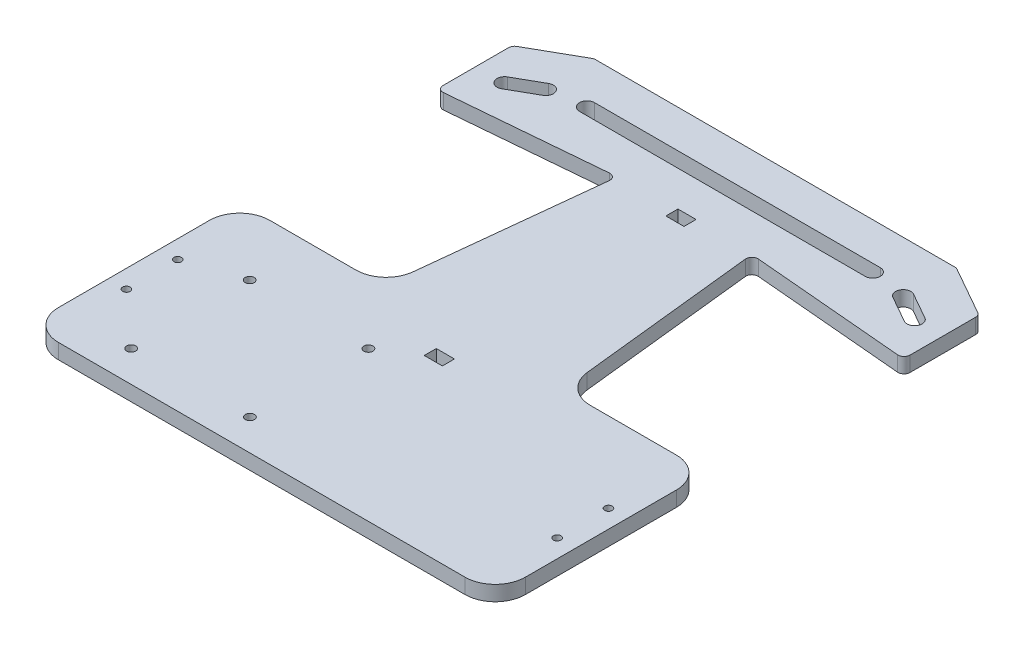
from build123d import *

# Parameters (mm, degrees)
SKETCH4_R           = 1.25
SKETCH4_R_2         = 1.5
SKETCH4_W           = 6
SKETCH4_H           = 4
BOSS_EXTRUDE1_DEPTH = 5
FILLET2_R           = 2


with BuildPart() as part:
    # Sketch4 → Boss-Extrude1 (new body)
    with BuildSketch(Plane(origin=(0, 0, 0), x_dir=(1, 0, 0), z_dir=(0, 1, 0))):
        with BuildLine():
            Line((67.306888039, -98.001348092), (-67.306888039, -98.001348092))
            ThreePointArc((-67.306888039, -98.001348092), (-74.37795585, -95.072415903), (-77.306888039, -88.001348092))
            Line((-77.306888039, -88.001348092), (-77.306888039, -38.001348092))
            ThreePointArc((-77.306888039, -38.001348092), (-74.37795585, -30.93028028), (-67.306888039, -28.001348092))
            Line((-67.306888039, -28.001348092), (-38.78630833, -28.001348092))
            ThreePointArc((-38.78630833, -28.001348092), (-32.105125256, -25.441898658), (-28.843972229, -19.073706639))
            Line((-28.843972229, -19.073706639), (-22.256841696, 41.998651908))
            Line((-22.256841696, 41.998651908), (-75.132576553, 37.372624533))
            ThreePointArc((-75.132576553, 37.372624533), (-76.658068454, 37.890459255), (-77.306888039, 39.365013929))
            Line((-77.306888039, 39.365013929), (-77.306888039, 62.182396927))
            Line((-77.306888039, 62.182396927), (-60, 71.998651908))
            Line((-60, 71.998651908), (60, 71.998651908))
            Line((60, 71.998651908), (77.306888039, 62.182396927))
            Line((77.306888039, 62.182396927), (77.306888039, 39.365013929))
            ThreePointArc((77.306888039, 39.365013929), (76.658068454, 37.890459255), (75.132576553, 37.372624533))
            Line((75.132576553, 37.372624533), (22.256841696, 41.998651908))
            Line((22.256841696, 41.998651908), (28.843972229, -19.073706639))
            ThreePointArc((28.843972229, -19.073706639), (32.105125256, -25.441898658), (38.78630833, -28.001348092))
            Line((38.78630833, -28.001348092), (67.306888039, -28.001348092))
            ThreePointArc((67.306888039, -28.001348092), (74.37795585, -30.93028028), (77.306888039, -38.001348092))
            Line((77.306888039, -38.001348092), (77.306888039, -88.001348092))
            ThreePointArc((77.306888039, -88.001348092), (74.37795585, -95.072415903), (67.306888039, -98.001348092))
        make_face()
        with Locations(Location((71.306888039, -54.501348092, 0), (0, 0, 270))):
            Circle(SKETCH4_R, mode=Mode.SUBTRACT)
        with Locations(Location((71.306888039, -71.501348092, 0), (0, 0, 270))):
            Circle(SKETCH4_R, mode=Mode.SUBTRACT)
        with Locations(Location((-71.306888039, -71.501348092, 0), (0, 0, 90))):
            Circle(SKETCH4_R, mode=Mode.SUBTRACT)
        with Locations(Location((-71.306888039, -54.501348092, 0), (0, 0, 90))):
            Circle(SKETCH4_R, mode=Mode.SUBTRACT)
        with Locations(Location((-53.526888039, -87.701348092, 0), (0, 0, 270))):
            Circle(SKETCH4_R_2, mode=Mode.SUBTRACT)
        with Locations(Location((-53.526888039, -48.461348092, 0), (0, 0, 270))):
            Circle(SKETCH4_R_2, mode=Mode.SUBTRACT)
        with Locations(Location((-14.216888039, -48.461348092, 0), (0, 0, 270))):
            Circle(SKETCH4_R_2, mode=Mode.SUBTRACT)
        with Locations(Location((-14.216888039, -87.701348092, 0), (0, 0, 270))):
            Circle(SKETCH4_R_2, mode=Mode.SUBTRACT)
        with BuildLine():
            Line((-47.306888039, 59.498651908), (47.306888039, 59.498651908))
            ThreePointArc((47.306888039, 59.498651908), (49.806888039, 56.998651908), (47.306888039, 54.498651908))
            Line((47.306888039, 54.498651908), (-47.306888039, 54.498651908))
            ThreePointArc((-47.306888039, 54.498651908), (-49.806888039, 56.998651908), (-47.306888039, 59.498651908))
        make_face(mode=Mode.SUBTRACT)
        with BuildLine():
            Line((-57.941248655, 53.047423499), (-66.639525671, 48.113867281))
            ThreePointArc((-66.639525671, 48.113867281), (-70.047483979, 49.055047481), (-69.10630378, 52.463005789))
            Line((-69.10630378, 52.463005789), (-60.408026764, 57.396562007))
            ThreePointArc((-60.408026764, 57.396562007), (-57.000068455, 56.455381807), (-57.941248655, 53.047423499))
        make_face(mode=Mode.SUBTRACT)
        with BuildLine():
            Line((57.941248655, 53.047423499), (66.639525671, 48.113867281))
            ThreePointArc((66.639525671, 48.113867281), (70.047483979, 49.055047481), (69.10630378, 52.463005789))
            Line((69.10630378, 52.463005789), (60.408026764, 57.396562007))
            ThreePointArc((60.408026764, 57.396562007), (57.000068455, 56.455381807), (57.941248655, 53.047423499))
        make_face(mode=Mode.SUBTRACT)
        with Locations((0, 40.807207385)):
            Rectangle(SKETCH4_W, SKETCH4_H, mode=Mode.SUBTRACT)
        with Locations((0, -39.192792615)):
            Rectangle(SKETCH4_W, SKETCH4_H, mode=Mode.SUBTRACT)
    extrude(amount=BOSS_EXTRUDE1_DEPTH)

    # Fillet2
    fillet2_edges = [part.edges().sort_by_distance(p)[0] for p in [
        (-22.256841696, 2.5, -41.998651908),
        (-77.306888039, 2.5, -62.182396927),
        (-60, 2.5, -71.998651908),
        (60, 2.5, -71.998651908),
        (77.306888039, 2.5, -62.182396927),
        (22.256841696, 2.5, -41.998651908),
    ]]
    fillet(fillet2_edges, radius=FILLET2_R)


solid = part.part
